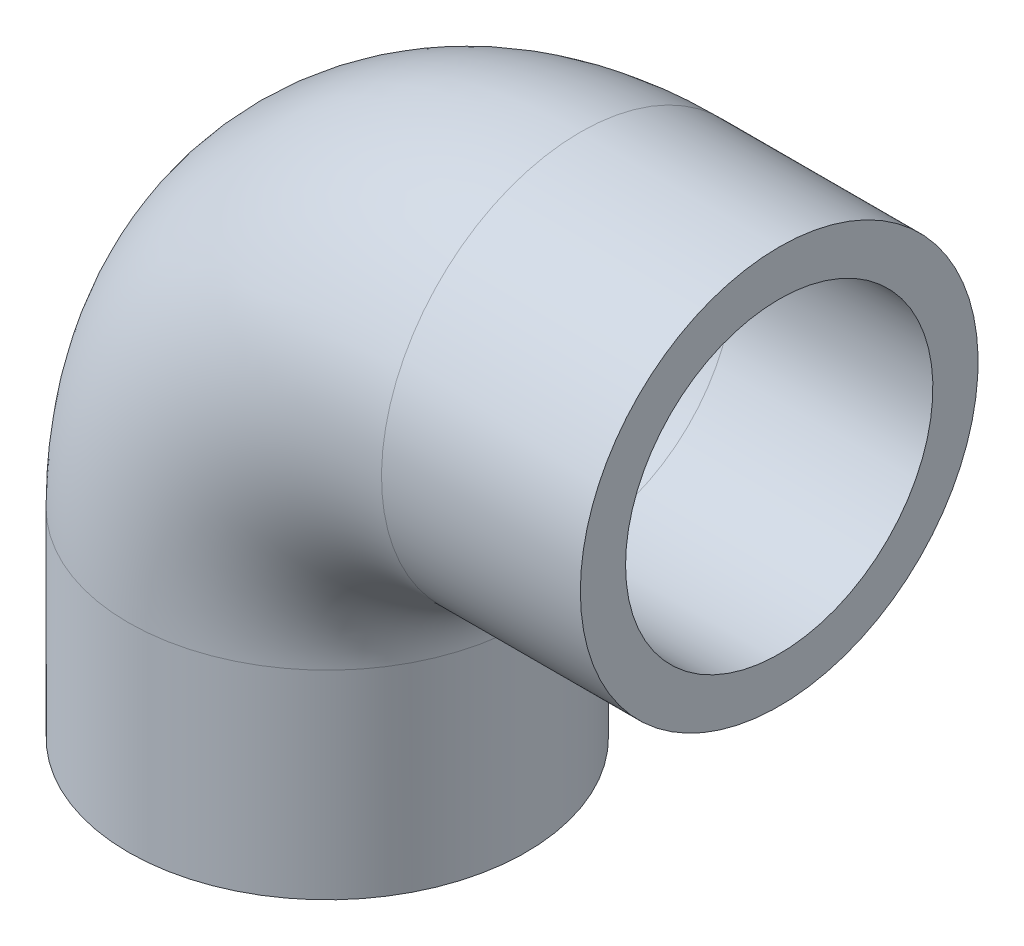
from build123d import *

# Parameters (mm, degrees)
SWEEP1_PROFILE_R   = 13.97
SHELL1_T           = -3.175
CUT_EXTRUDE1_START = -13.208
SKETCH28_R         = 10.795
CUT_EXTRUDE1_DEPTH = 13.208


with BuildPart() as part:
    # Sweep1: sweep along a path in Sketch1
    with BuildLine(Plane.XY) as sweep1_path:
        Line((0, 0), (0, 13.97))
        ThreePointArc((0, 13.97), (5.207641431, 26.542358569), (17.78, 31.75))
        Line((17.78, 31.75), (31.75, 31.75))
    # Sweep1 profile (on start of the path) → Sweep1 (sweep)
    with BuildSketch(Plane.ZX):
        Circle(SWEEP1_PROFILE_R)
    sweep(path=sweep1_path.line)

    # Shell1
    shell1_openings = [part.faces().sort_by_distance(p)[0] for p in [
        (31.75, 31.75, 0),
    ]]
    offset(amount=SHELL1_T, openings=shell1_openings, kind=Kind.INTERSECTION)

    # Sketch28 → Cut-Extrude1 (cut)
    with BuildSketch(Plane.XZ.offset(CUT_EXTRUDE1_START)):
        with Locations(Location((0, 0, 0), (0, 0, 180))):
            Circle(SKETCH28_R)
    extrude(amount=CUT_EXTRUDE1_DEPTH, mode=Mode.SUBTRACT)


solid = part.part
